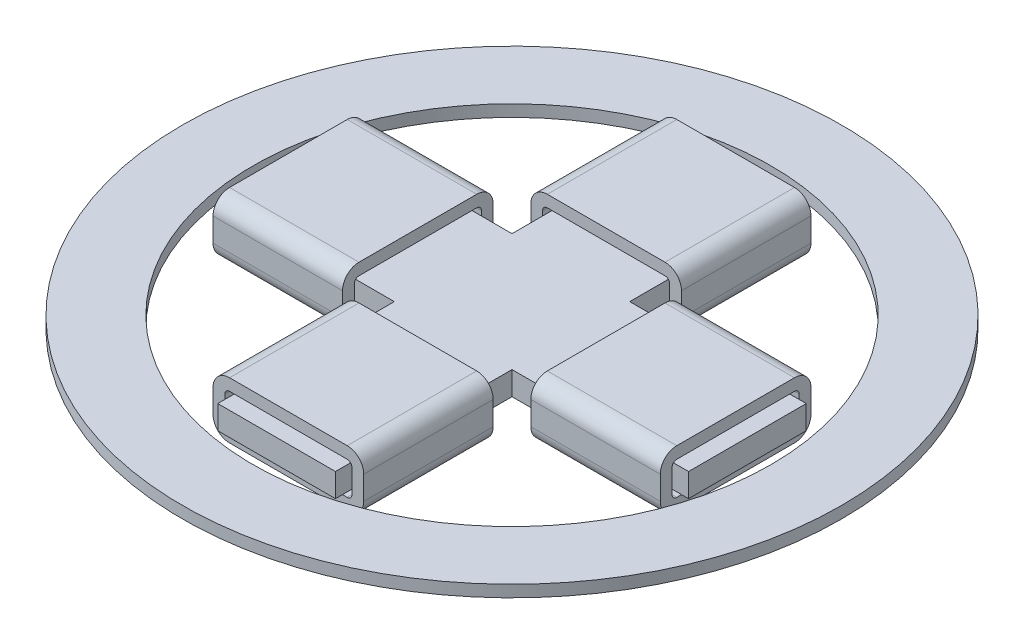
from build123d import *

# Parameters (mm, degrees)
EXTRUDE_1_DEPTH          = 1
EXTRUDE_START            = 4
EXTRUDE_1_2_DEPTH        = 5.5
PATTERN_CIRCULAR_1_COUNT = 4
SKETCH_4_R               = 14
SKETCH_4_R_2             = 11
EXTRUDE_2_DEPTH          = 0.5


with BuildPart() as part:
    # 草图1 → Extrude 1 (new body)
    with BuildSketch(Plane(origin=(0, 0, 0), x_dir=(1, 0, 0), z_dir=(0, 1, 0))):
        Polygon((-2.5, -2.5), (-2.5, -10), (2.5, -10), (2.5, -2.5), (10, -2.5), (10, 2.5), (2.5, 2.5), (2.5, 10), (-2.5, 10), (-2.5, 2.5), (-10, 2.5), (-10, -2.5), align=None)
    extrude(amount=EXTRUDE_1_DEPTH)


with BuildPart() as body_2:
    # 草图2 → Extrude 1 2 (new body)
    with BuildSketch(Plane(origin=(0, 0, 0), x_dir=(0, 0, -1), z_dir=(1, 0, 0)).offset(EXTRUDE_START)):
        with BuildLine():
            Line((-2.5, 1.7), (2.5, 1.7))
            ThreePointArc((2.5, 1.7), (2.994974747, 1.494974747), (3.2, 1))
            Line((3.2, 1), (3.2, 0))
            ThreePointArc((3.2, 0), (2.994974747, -0.494974747), (2.5, -0.7))
            Line((2.5, -0.7), (-2.5, -0.7))
            ThreePointArc((-2.5, -0.7), (-2.994974747, -0.494974747), (-3.2, 0))
            Line((-3.2, 0), (-3.2, 1))
            ThreePointArc((-3.2, 1), (-2.994974747, 1.494974747), (-2.5, 1.7))
        make_face()
        with BuildLine():
            Line((-2.5, 1.2), (2.5, 1.2))
            ThreePointArc((2.5, 1.2), (2.641421356, 1.141421356), (2.7, 1))
            Line((2.7, 1), (2.7, 0))
            ThreePointArc((2.7, 0), (2.641421356, -0.141421356), (2.5, -0.2))
            Line((2.5, -0.2), (-2.5, -0.2))
            ThreePointArc((-2.5, -0.2), (-2.641421356, -0.141421356), (-2.7, 0))
            Line((-2.7, 0), (-2.7, 1))
            ThreePointArc((-2.7, 1), (-2.641421356, 1.141421356), (-2.5, 1.2))
        make_face(mode=Mode.SUBTRACT)
    extrude(amount=EXTRUDE_1_2_DEPTH)


with BuildPart() as pattern_circular_1_1:
    # 阵列(圆周)1: pattern copy
    add(body_2.part.rotate(Axis((0, 0, 0), (0, 1, 0)), 1 * 360 / PATTERN_CIRCULAR_1_COUNT))


with BuildPart() as pattern_circular_1_2:
    # 阵列(圆周)1: pattern copy
    add(body_2.part.rotate(Axis((0, 0, 0), (0, 1, 0)), 2 * 360 / PATTERN_CIRCULAR_1_COUNT))


with BuildPart() as pattern_circular_1_3:
    # 阵列(圆周)1: pattern copy
    add(body_2.part.rotate(Axis((0, 0, 0), (0, 1, 0)), 3 * 360 / PATTERN_CIRCULAR_1_COUNT))


with BuildPart() as body_6:
    # 草图4 → 拉伸-薄壁2 (new body)
    with BuildSketch(Plane(origin=(0, 0, 0), x_dir=(1, 0, 0), z_dir=(0, 1, 0))):
        Circle(SKETCH_4_R)
        Circle(SKETCH_4_R_2, mode=Mode.SUBTRACT)
    extrude(amount=EXTRUDE_2_DEPTH)


solid = Compound([part.part, body_2.part, pattern_circular_1_1.part, pattern_circular_1_2.part, pattern_circular_1_3.part, body_6.part])
